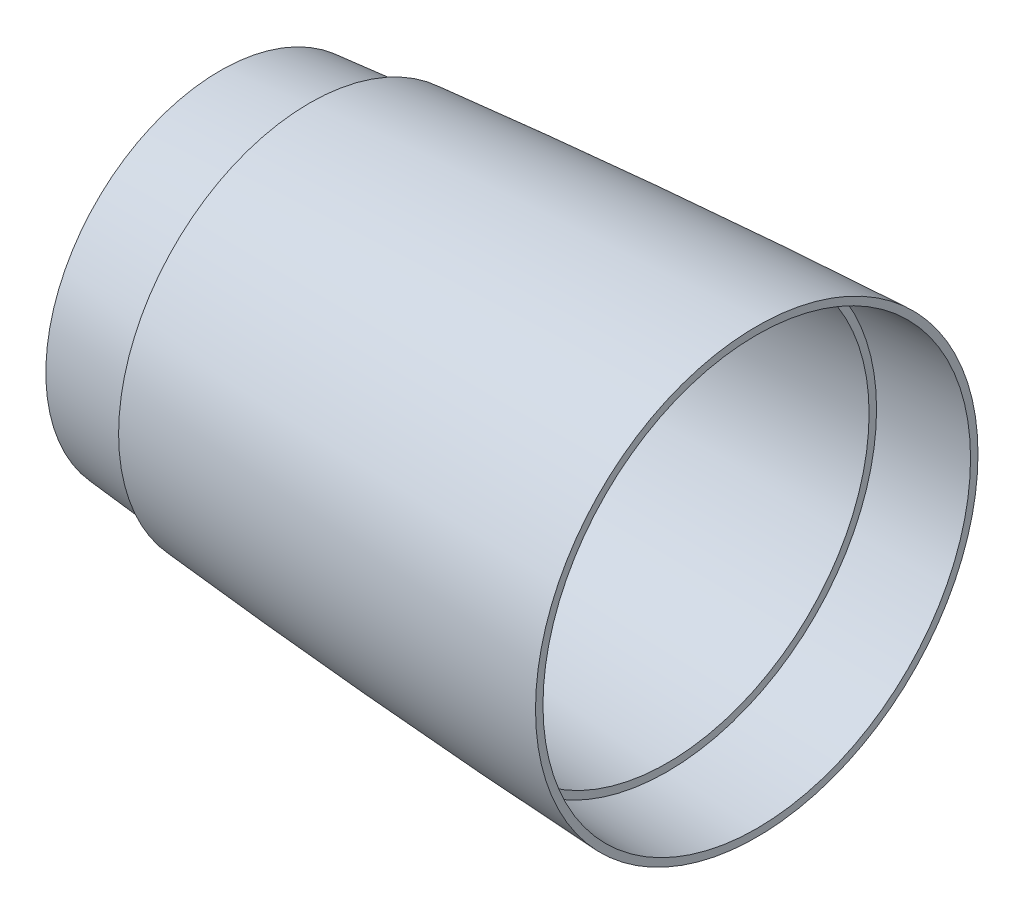
from build123d import *


with BuildPart() as part:
    # Sketch1 → Revolve1 (revolve)
    with BuildSketch(Plane.XY, mode=Mode.PRIVATE) as revolve1_sk:
        with BuildLine():
            Line((-170, 3629.020391235), (-170, 3631.523130864))
            ThreePointArc((-170, 3631.523130864), (-245.052389868, 3627.231668397), (-320, 3621.389270708))
            Line((-320, 3621.389270708), (-320, 3618.879522725))
            Line((-320, 3618.879522725), (-320, 3618.57835206))
            ThreePointArc((-320, 3618.57835206), (-335.002880401, 3617.220253195), (-350, 3615.799951601))
            Line((-350, 3615.799951601), (-350, 3613.589662649))
            ThreePointArc((-350, 3613.589662649), (-275.059038083, 3620.065299904), (-200, 3624.986931011))
            Line((-200, 3624.986931011), (-200, 3627.190274855))
            Line((-200, 3627.190274855), (-200, 3627.490730519))
            ThreePointArc((-200, 3627.490730519), (-185.001580981, 3628.286567381), (-170, 3629.020391235))
        make_face()
    revolve(revolve1_sk.sketch.rotate(Axis((0, 3557.296761587, 0), (-1, 0, 0)), 90), axis=Axis((0, 3557.296761587, 0), (-1, 0, 0)))


solid = part.part
